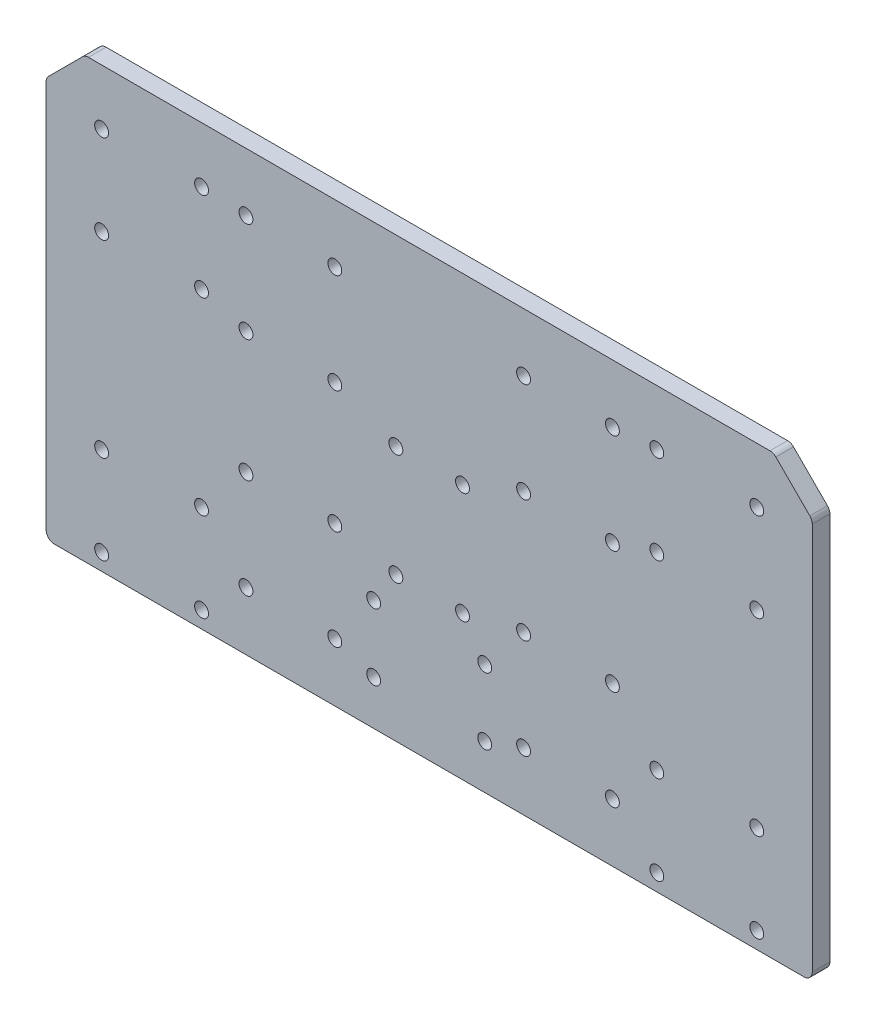
from build123d import *

# Parameters (mm, degrees)
SKETCH1_W           = 276
SKETCH1_H           = 144
SKETCH1_R           = 2.5
BOSS_EXTRUDE1_DEPTH = 6.35
SKETCH2_R           = 2.5
CUT_EXTRUDE1_DEPTH  = 156.782933918
BOSS_EXTRUDE2_DEPTH = 6.35
SKETCH4_R           = 2.5
CUT_EXTRUDE2_DEPTH  = 163.727755776
FILLET1_R           = 3
SKETCH5_R           = 2.5
CUT_EXTRUDE3_DEPTH  = 163.727755776
SKETCH6_R           = 2.5
CUT_EXTRUDE4_DEPTH  = 163.727755776


with BuildPart() as part:
    # Sketch1 → Boss-Extrude1 (new body)
    with BuildSketch(Plane.XY):
        Rectangle(SKETCH1_W, SKETCH1_H)
        with Locations((-118, -66)):
            Circle(SKETCH1_R, mode=Mode.SUBTRACT)
        with Locations((-82, -66)):
            Circle(SKETCH1_R, mode=Mode.SUBTRACT)
        with Locations((-82, -34)):
            Circle(SKETCH1_R, mode=Mode.SUBTRACT)
        with Locations((-118, -34)):
            Circle(SKETCH1_R, mode=Mode.SUBTRACT)
        with Locations(Location((-118, 66, 0), (0, 0, 180))):
            Circle(SKETCH1_R, mode=Mode.SUBTRACT)
        with Locations(Location((-82, 66, 0), (0, 0, 180))):
            Circle(SKETCH1_R, mode=Mode.SUBTRACT)
        with Locations(Location((-82, 34, 0), (0, 0, 180))):
            Circle(SKETCH1_R, mode=Mode.SUBTRACT)
        with Locations(Location((-118, 34, 0), (0, 0, 180))):
            Circle(SKETCH1_R, mode=Mode.SUBTRACT)
        with Locations(Location((118, -66, 0), (0, 0, 180))):
            Circle(SKETCH1_R, mode=Mode.SUBTRACT)
        with Locations(Location((82, -66, 0), (0, 0, 180))):
            Circle(SKETCH1_R, mode=Mode.SUBTRACT)
        with Locations(Location((82, -34, 0), (0, 0, 180))):
            Circle(SKETCH1_R, mode=Mode.SUBTRACT)
        with Locations(Location((118, -34, 0), (0, 0, 180))):
            Circle(SKETCH1_R, mode=Mode.SUBTRACT)
        with Locations((118, 34)):
            Circle(SKETCH1_R, mode=Mode.SUBTRACT)
        with Locations((82, 34)):
            Circle(SKETCH1_R, mode=Mode.SUBTRACT)
        with Locations((82, 66)):
            Circle(SKETCH1_R, mode=Mode.SUBTRACT)
        with Locations((118, 66)):
            Circle(SKETCH1_R, mode=Mode.SUBTRACT)
    extrude(amount=BOSS_EXTRUDE1_DEPTH)

    # Sketch2 → Cut-Extrude1 (cut, through all)
    with BuildSketch(Plane.XY.offset(6.35)):
        with Locations((-66, -15)):
            Circle(SKETCH2_R)
        with Locations((-34, -15)):
            Circle(SKETCH2_R)
        with Locations(Location((-34, -51, 0), (0, 0, 180))):
            Circle(SKETCH2_R)
        with Locations(Location((-66, -51, 0), (0, 0, 180))):
            Circle(SKETCH2_R)
        with Locations((66, -51)):
            Circle(SKETCH2_R)
        with Locations((34, -51)):
            Circle(SKETCH2_R)
        with Locations(Location((34, -15, 0), (0, 0, 180))):
            Circle(SKETCH2_R)
        with Locations(Location((66, -15, 0), (0, 0, 180))):
            Circle(SKETCH2_R)
    extrude(amount=-CUT_EXTRUDE1_DEPTH, mode=Mode.SUBTRACT)

    # Sketch3 → Boss-Extrude2 (add, through all)
    with BuildSketch(Plane.XY.offset(6.35)):
        Polygon((-138, 72), (-124, 86), (124, 86), (138, 72), align=None)
    extrude(amount=-BOSS_EXTRUDE2_DEPTH)

    # Sketch4 → Cut-Extrude2 (cut, through all)
    with BuildSketch(Plane.XY.offset(6.35)):
        with Locations((-66, -15)):
            Circle(SKETCH4_R)
        with Locations((-34, -15)):
            Circle(SKETCH4_R)
        with Locations(Location((-34, -51, 0), (0, 0, 180))):
            Circle(SKETCH4_R)
        with Locations(Location((-66, -51, 0), (0, 0, 180))):
            Circle(SKETCH4_R)
        with Locations((-66, 29)):
            Circle(SKETCH4_R)
        with Locations((-66, 65)):
            Circle(SKETCH4_R)
        with Locations((-34, 65)):
            Circle(SKETCH4_R)
        with Locations((-34, 29)):
            Circle(SKETCH4_R)
        with Locations(Location((34, 29, 0), (0, 0, 180))):
            Circle(SKETCH4_R)
        with Locations(Location((34, 65, 0), (0, 0, 180))):
            Circle(SKETCH4_R)
        with Locations(Location((66, 65, 0), (0, 0, 180))):
            Circle(SKETCH4_R)
        with Locations(Location((66, 29, 0), (0, 0, 180))):
            Circle(SKETCH4_R)
        with Locations((34, -51)):
            Circle(SKETCH4_R)
        with Locations(Location((34, -15, 0), (0, 0, 180))):
            Circle(SKETCH4_R)
        with Locations(Location((66, -15, 0), (0, 0, 180))):
            Circle(SKETCH4_R)
        with Locations((66, -51)):
            Circle(SKETCH4_R)
    extrude(amount=-CUT_EXTRUDE2_DEPTH, mode=Mode.SUBTRACT)

    # Fillet1
    fillet1_edges = [part.edges().sort_by_distance(p)[0] for p in [
        (-124, 86, 3.175),
        (124, 86, 3.175),
        (138, -72, 3.175),
        (-138, -72, 3.175),
        (-138, 72, 3.175),
        (138, 72, 3.175),
    ]]
    fillet(fillet1_edges, radius=FILLET1_R)

    # Sketch5 → Cut-Extrude3 (cut, through all)
    with BuildSketch(Plane.XY.offset(6.35)):
        with Locations((-20, -32)):
            Circle(SKETCH5_R)
        with Locations(Location((20, -32, 0), (0, 0, 180))):
            Circle(SKETCH5_R)
        with Locations((20, -56)):
            Circle(SKETCH5_R)
        with Locations(Location((-20, -56, 0), (0, 0, 180))):
            Circle(SKETCH5_R)
    extrude(amount=-CUT_EXTRUDE3_DEPTH, mode=Mode.SUBTRACT)

    # Sketch6 → Cut-Extrude4 (cut, through all)
    with BuildSketch(Plane.XY.offset(6.35)):
        with Locations((12, 20)):
            Circle(SKETCH6_R)
        with Locations(Location((12, -20, 0), (0, 0, 180))):
            Circle(SKETCH6_R)
        with Locations((-12, -20)):
            Circle(SKETCH6_R)
        with Locations(Location((-12, 20, 0), (0, 0, 180))):
            Circle(SKETCH6_R)
    extrude(amount=-CUT_EXTRUDE4_DEPTH, mode=Mode.SUBTRACT)


solid = part.part
